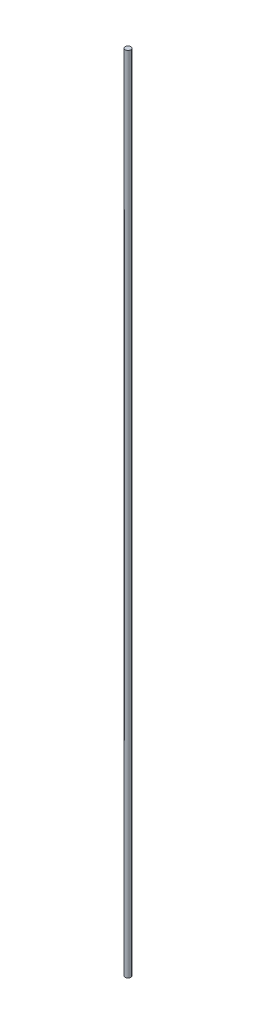
from build123d import *

# Parameters (mm, degrees)
SKETCH1_W = 0.75
SKETCH1_H = 219


with BuildPart() as part:
    # Sketch1 → Varilla_carbono (revolve)
    with BuildSketch(Plane.XY, mode=Mode.PRIVATE) as varilla_carbono_sk:
        with Locations((0.375, -110.5)):
            Rectangle(SKETCH1_W, SKETCH1_H)
    revolve(varilla_carbono_sk.sketch.rotate(Axis((0, -224, 0), (0, 1, 0)), 90), axis=Axis((0, -224, 0), (0, 1, 0)))


solid = part.part
